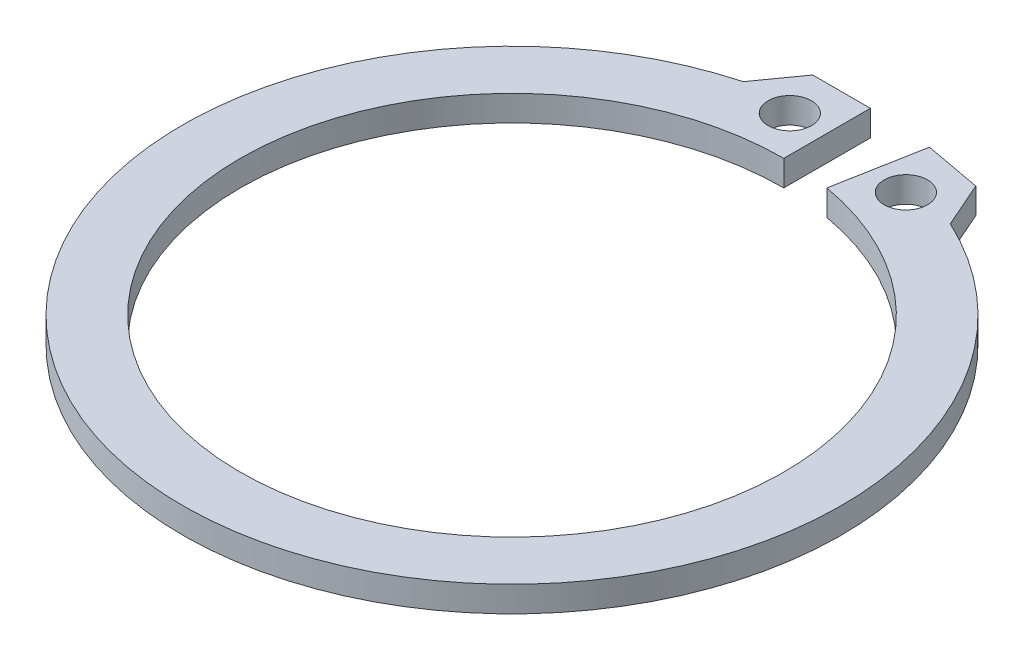
from build123d import *

# Parameters (mm, degrees)
BOSS_EXTRUDE1_DEPTH = 0.889
SKETCH4_R           = 0.75
CUT_EXTRUDE2_DEPTH  = 0.889


with BuildPart() as part:
    # Sketch1 → Boss-Extrude1 (new body)
    with BuildSketch(Plane(origin=(0, 0, 0), x_dir=(1, 0, 0), z_dir=(0, 1, 0))):
        with BuildLine():
            Line((0, 12.414484685), (-2, 12.414484685))
            Line((-2, 12.414484685), (-3, 11.013194842))
            ThreePointArc((-3, 11.013194842), (-0.984968358, -11.371908281), (4.848914718, 10.333367635))
            Line((4.848914718, 10.333367635), (4.155731478, 11.908137913))
            Line((4.155731478, 11.908137913), (2.189008602, 12.271457509))
            Line((2.189008602, 12.271457509), (1.634808109, 9.271457509))
            ThreePointArc((1.634808109, 9.271457509), (-0.820526405, -9.378659729), (0, 9.414484685))
            Line((0, 9.414484685), (0, 12.414484685))
        make_face()
    extrude(amount=BOSS_EXTRUDE1_DEPTH)

    # Sketch4 → Cut-Extrude2 (cut)
    with BuildSketch(Plane(origin=(0, 0.889, 0), x_dir=(1, 0, 0), z_dir=(0, 1, 0))):
        with Locations(Location((-1.25, 10.872808275, 0), (0, 0, 270))):
            Circle(SKETCH4_R)
        with Locations(Location((3.134471061, 10.508444008, 0), (0, 0, 270))):
            Circle(SKETCH4_R)
    extrude(amount=-CUT_EXTRUDE2_DEPTH, mode=Mode.SUBTRACT)


solid = part.part
